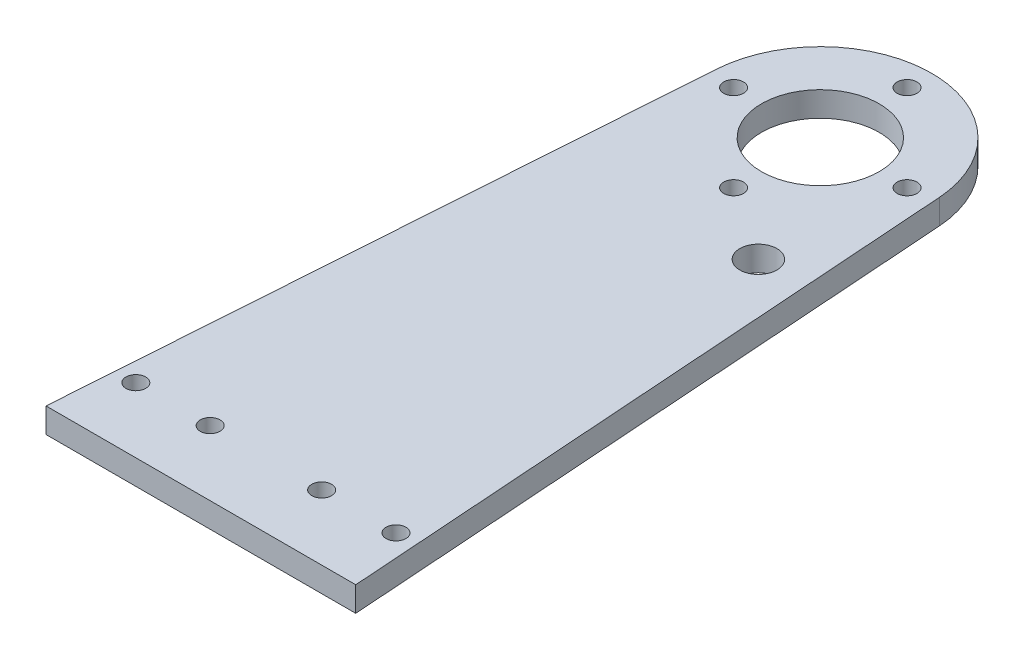
from build123d import *

# Parameters (mm, degrees)
SKETCH_1_R      = 9.5
SKETCH_1_R_2    = 1.6
SKETCH_1_R_3    = 3
EXTRUDE_1_DEPTH = 4


with BuildPart() as part:
    # 草图1 → 凸台-拉伸1 (new body)
    with BuildSketch(Plane(origin=(0, 0, 0), x_dir=(1, 0, 0), z_dir=(0, 1, 0))):
        with BuildLine():
            Line((-25, -100), (25, -100))
            Line((25, -100), (17.956603851, 1.249150963))
            ThreePointArc((17.956603851, 1.249150963), (0, 18), (-17.956603851, 1.249150963))
            Line((-17.956603851, 1.249150963), (-25, -100))
        make_face()
        with Locations(Location((0, 0, 0), (0, 0, 270))):
            Circle(SKETCH_1_R, mode=Mode.SUBTRACT)
        with Locations(Location((-14, 0, 0), (0, 0, 270))):
            Circle(SKETCH_1_R_2, mode=Mode.SUBTRACT)
        with Locations(Location((0, -14, 0), (0, 0, 270))):
            Circle(SKETCH_1_R_2, mode=Mode.SUBTRACT)
        with Locations(Location((14, 0, 0), (0, 0, 270))):
            Circle(SKETCH_1_R_2, mode=Mode.SUBTRACT)
        with Locations(Location((0, 14, 0), (0, 0, 270))):
            Circle(SKETCH_1_R_2, mode=Mode.SUBTRACT)
        with Locations(Location((9, -89.5, 0), (0, 0, 270))):
            Circle(SKETCH_1_R_2, mode=Mode.SUBTRACT)
        with Locations(Location((21, -89.5, 0), (0, 0, 270))):
            Circle(SKETCH_1_R_2, mode=Mode.SUBTRACT)
        with Locations(Location((-21, -89.5, 0), (0, 0, 270))):
            Circle(SKETCH_1_R_2, mode=Mode.SUBTRACT)
        with Locations(Location((-9, -89.5, 0), (0, 0, 270))):
            Circle(SKETCH_1_R_2, mode=Mode.SUBTRACT)
        with Locations(Location((12, -22, 0), (0, 0, 270))):
            Circle(SKETCH_1_R_3, mode=Mode.SUBTRACT)
    extrude(amount=EXTRUDE_1_DEPTH)


solid = part.part
